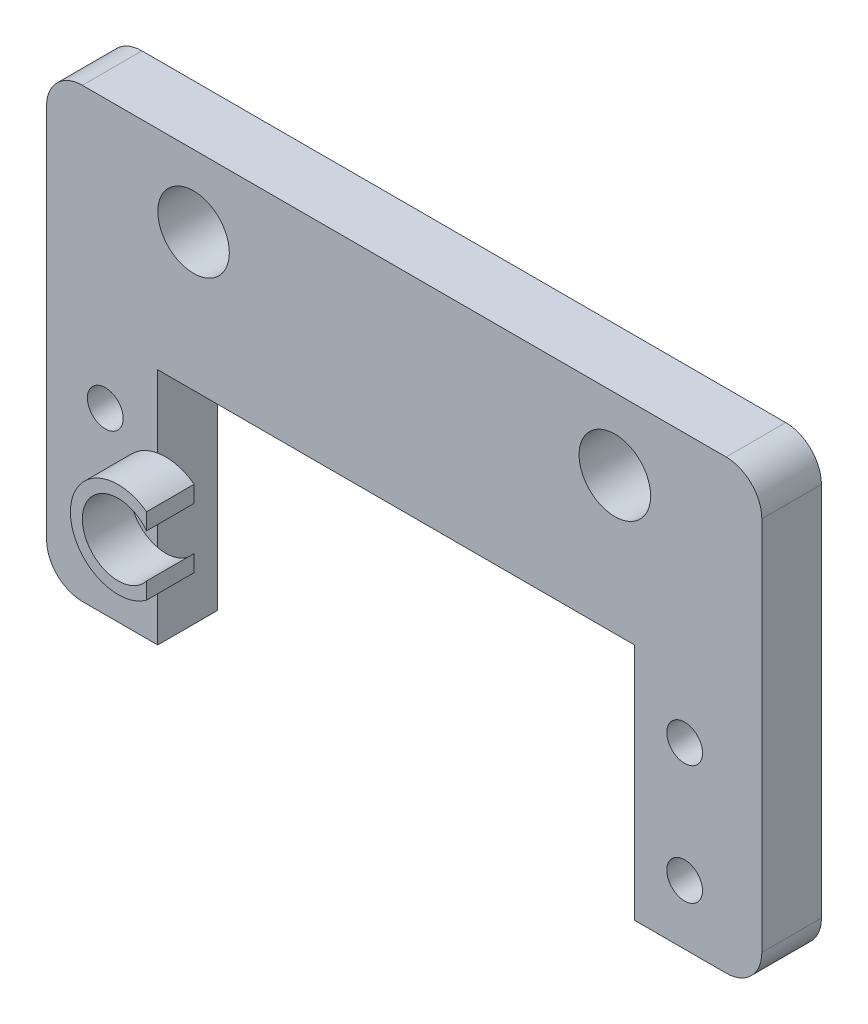
from build123d import *

# Parameters (mm, degrees)
SKETCH_1_R          = 1.5
EXTRUDE_1_DEPTH     = 5
SKETCH_2_R          = 3
CUT_EXTRUDE_1_DEPTH = 10
SKETCH_3_R          = 4
SKETCH_3_R_2        = 3
EXTRUDE_1_2_DEPTH   = 4
CUT_EXTRUDE_START   = -4
CUT_EXTRUDE_2_DEPTH = 4


with BuildPart() as part:
    # 草图1 → Extrude 1 (new body)
    with BuildSketch(Plane.XY):
        with BuildLine():
            Line((-15.5, 27.5), (38.5, 27.5))
            ThreePointArc((38.5, 27.5), (40.621320344, 26.621320344), (41.5, 24.5))
            Line((41.5, 24.5), (41.5, -7))
            ThreePointArc((41.5, -7), (40.621320344, -9.121320344), (38.5, -10))
            Line((38.5, -10), (33.3, -10))
            Line((33.3, -10), (30.825, -10))
            Line((30.825, -10), (30.825, 10))
            Line((30.825, 10), (-9.175, 10))
            Line((-9.175, 10), (-9.175, -10))
            Line((-9.175, -10), (-15.5, -10))
            ThreePointArc((-15.5, -10), (-17.621320344, -9.121320344), (-18.5, -7))
            Line((-18.5, -7), (-18.5, 24.5))
            ThreePointArc((-18.5, 24.5), (-17.621320344, 26.621320344), (-15.5, 27.5))
        make_face()
        with Locations((-13.575, 5)):
            Circle(SKETCH_1_R, mode=Mode.SUBTRACT)
        with Locations((-13.575, -5)):
            Circle(SKETCH_1_R, mode=Mode.SUBTRACT)
        with Locations((35.025, 5)):
            Circle(SKETCH_1_R, mode=Mode.SUBTRACT)
        with Locations((35.025, -5)):
            Circle(SKETCH_1_R, mode=Mode.SUBTRACT)
    extrude(amount=EXTRUDE_1_DEPTH)

    # 草图2 → 切除-拉伸1 (cut)
    with BuildSketch(Plane.XY.offset(5)):
        with Locations((-6.17, 21.5)):
            Circle(SKETCH_2_R)
        with Locations((29.17, 21.5)):
            Circle(SKETCH_2_R)
    extrude(amount=-CUT_EXTRUDE_1_DEPTH, mode=Mode.SUBTRACT)

    # 草图3 → Extrude 1 2 (add)
    with BuildSketch(Plane.XY.offset(5)):
        with Locations((-8.5, 0)):
            Circle(SKETCH_3_R)
        with Locations((-8.5, 0)):
            Circle(SKETCH_3_R_2, mode=Mode.SUBTRACT)
    extrude(amount=EXTRUDE_1_2_DEPTH)

    # 草图5 → 切除-拉伸2 (cut)
    with BuildSketch(Plane.XY.offset(9).offset(CUT_EXTRUDE_START)):
        with BuildLine():
            Line((-6.115117964, 3.211282871), (-6.115117964, -3.211282871))
            ThreePointArc((-6.115117964, -3.211282871), (-4.5, 0), (-6.115117964, 3.211282871))
        make_face()
    extrude(amount=CUT_EXTRUDE_2_DEPTH, mode=Mode.SUBTRACT)


solid = part.part
